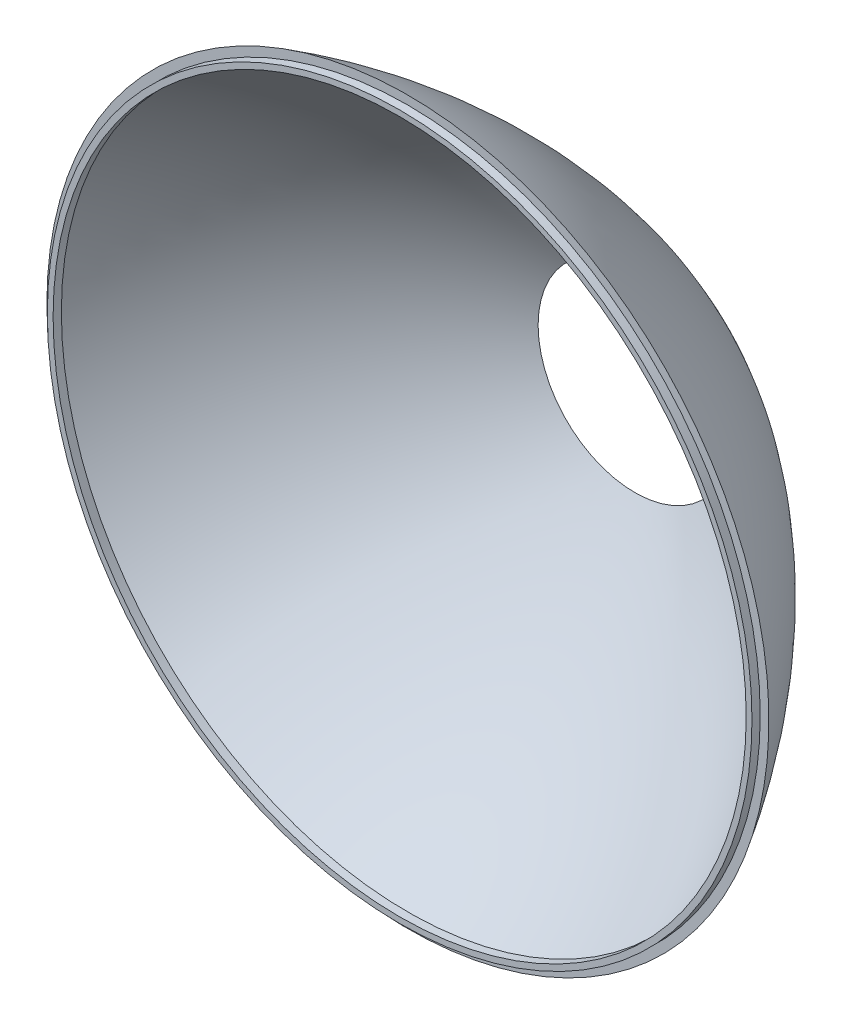
from build123d import *

# Parameters (mm, degrees)
SKETCH4_R           = 85.391174644
SKETCH4_R_2         = 83.991174644
BOSS_EXTRUDE1_DEPTH = 2


with BuildPart() as part:
    # Sketch2 → Revolve1 (revolve)
    with BuildSketch(Plane(origin=(0, 0, 0), x_dir=(1, 0, 0), z_dir=(0, 1, 0)), mode=Mode.PRIVATE) as revolve1_sk:
        with BuildLine():
            Line((30, 55), (23.442880624, 55))
            ThreePointArc((23.442880624, 55), (57.619715582, 31.796383588), (83.991174644, 0))
            Line((83.991174644, 0), (87.5, 0))
            ThreePointArc((87.5, 0), (62.463417443, 31.382209145), (30, 55))
        make_face()
    revolve(revolve1_sk.sketch.rotate(Axis((0, 0, -55), (0, 0, 1)), 180), axis=Axis((0, 0, -55), (0, 0, 1)))

    # Sketch4 → Boss-Extrude1 (add)
    with BuildSketch(Plane.XY):
        with Locations(Location((0, 0, 0), (0, 0, 180))):
            Circle(SKETCH4_R)
        with Locations(Location((0, 0, 0), (0, 0, 180))):
            Circle(SKETCH4_R_2, mode=Mode.SUBTRACT)
    extrude(amount=BOSS_EXTRUDE1_DEPTH)


solid = part.part
